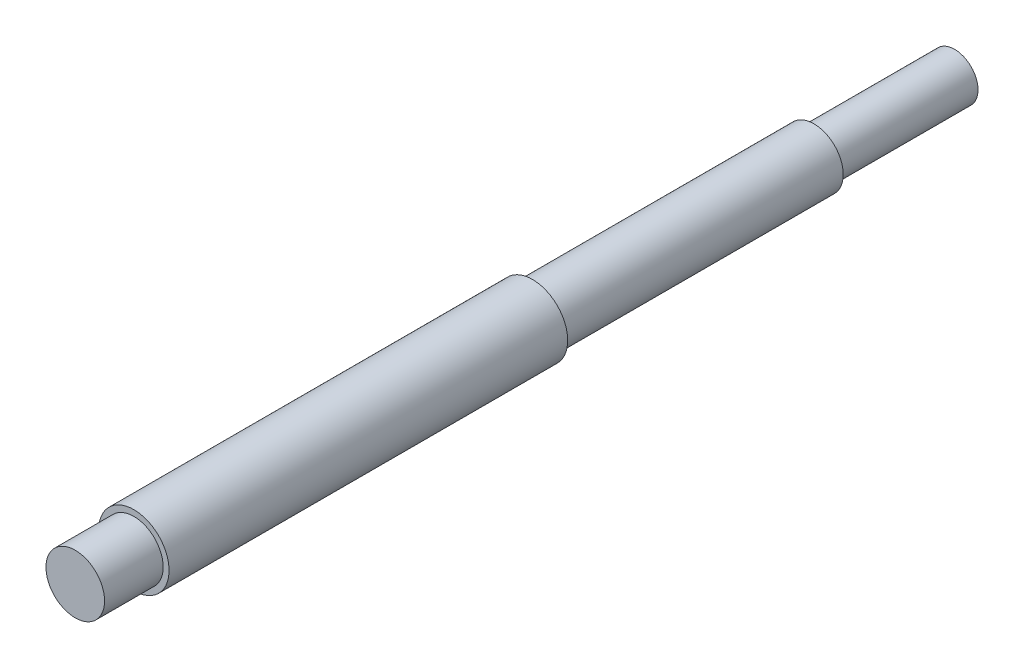
from build123d import *

# Parameters (mm, degrees)
SKETCH_1_R      = 2.5
EXTRUDE_1_DEPTH = 5
SKETCH_2_R      = 3
EXTRUDE_2_DEPTH = 34
EXTRUDE_START   = 24
SKETCH_3_R      = 2.5
EXTRUDE_3_DEPTH = 24
SKETCH_4_R      = 2
EXTRUDE_4_DEPTH = 12


with BuildPart() as part:
    # 草图1 → 凸台-拉伸1 (new body)
    with BuildSketch(Plane.XY):
        Circle(SKETCH_1_R)
    extrude(amount=EXTRUDE_1_DEPTH)

    # 草图2 → 凸台-拉伸2 (add)
    with BuildSketch(Plane(origin=(0, 0, 0), x_dir=(-1, 0, 0), z_dir=(0, 0, -1))):
        Circle(SKETCH_2_R)
    extrude(amount=EXTRUDE_2_DEPTH)

    # 草图3 → 凸台-拉伸3 (add)
    with BuildSketch(Plane(origin=(0, 0, -34), x_dir=(-1, 0, 0), z_dir=(0, 0, -1)).offset(EXTRUDE_START)):
        with Locations(Location((0, 0, 0), (0, 0, 180))):
            Circle(SKETCH_3_R)
    extrude(amount=-EXTRUDE_3_DEPTH)

    # 草图4 → 凸台-拉伸4 (add)
    with BuildSketch(Plane(origin=(0, 0, -58), x_dir=(-1, 0, 0), z_dir=(0, 0, -1))):
        Circle(SKETCH_4_R)
    extrude(amount=EXTRUDE_4_DEPTH)


solid = part.part
